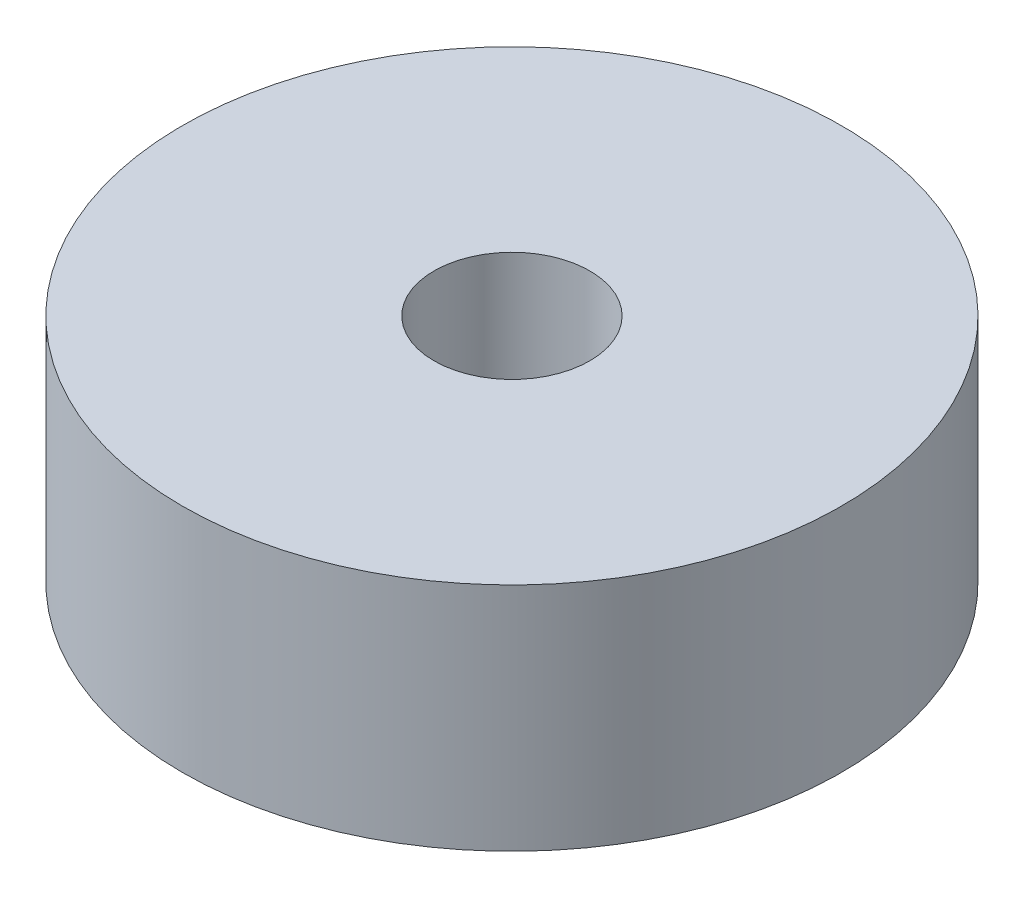
from build123d import *

# Parameters (mm, degrees)
SKETCH1_R                   = 14.2875
BOSS_EXTRUDE1_DEPTH         = 10
F_1_4_CLEARANCE_HOLE1_D     = 6.7564
F_1_4_CLEARANCE_HOLE1_DEPTH = 10
F_1_4_CLEARANCE_HOLE1_TIP   = 2.029827343


with BuildPart() as part:
    # Sketch1 → Boss-Extrude1 (new body)
    with BuildSketch(Plane(origin=(0, 0, 0), x_dir=(1, 0, 0), z_dir=(0, 1, 0))):
        Circle(SKETCH1_R)
    extrude(amount=BOSS_EXTRUDE1_DEPTH)

    # 1/4 Clearance Hole1
    with Locations(Plane(origin=(0, 10, 0), x_dir=(1, 0, 0), z_dir=(0, 1, 0))):
        with Locations((0, 0)):
            Hole(F_1_4_CLEARANCE_HOLE1_D / 2, depth=F_1_4_CLEARANCE_HOLE1_DEPTH)
            with Locations((0, 0, -(F_1_4_CLEARANCE_HOLE1_DEPTH + F_1_4_CLEARANCE_HOLE1_TIP / 2))):  # 118° drill point
                Cone(0, F_1_4_CLEARANCE_HOLE1_D / 2, F_1_4_CLEARANCE_HOLE1_TIP, mode=Mode.SUBTRACT)


solid = part.part
